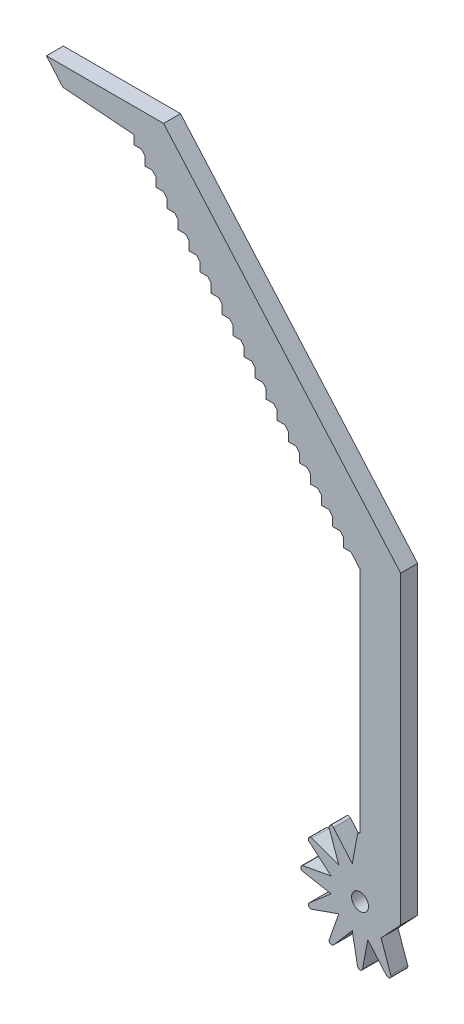
from build123d import *

# Parameters (mm, degrees)
SKETCH2_R           = 8.75
BOSS_EXTRUDE1_DEPTH = 5
SKETCH2_3_R         = 2.5
CUT_EXTRUDE1_DEPTH  = 31
BOSS_EXTRUDE2_DEPTH = 5
CIRPATTERN2_COUNT   = 8
CIRPATTERN2_ANGLE   = 210
BOSS_EXTRUDE3_DEPTH = 5
BOSS_EXTRUDE4_START = -5
BOSS_EXTRUDE4_DEPTH = 5
CUT_EXTRUDE2_START  = -5
SKETCH7_R           = 2.5
CUT_EXTRUDE2_DEPTH  = 5
BOSS_EXTRUDE5_DEPTH = 5
LPATTERN1_COUNT     = 20
LPATTERN1_PITCH     = 5


with BuildPart() as part:
    # Sketch2 → Boss-Extrude1 (new body)
    with BuildSketch(Plane.XY):
        Circle(SKETCH2_R)
    extrude(amount=BOSS_EXTRUDE1_DEPTH)

    # Sketch2<3> → Cut-Extrude1 (cut)
    with BuildSketch(Plane.XY):
        Circle(SKETCH2_3_R)
    extrude(amount=CUT_EXTRUDE1_DEPTH, mode=Mode.SUBTRACT)

    # Sketch2<4> → Boss-Extrude2 (add)
    with BuildSketch(Plane.XY):
        with BuildLine():
            Line((0, 7.99133798), (-2.4, 7.99133798))
            Line((-2.4, 7.99133798), (-0.737233852, 16.887790594))
            ThreePointArc((-0.737233852, 16.887790594), (0, 17.5), (0.737233852, 16.887790594))
            Line((0.737233852, 16.887790594), (2.4, 7.99133798))
            Line((2.4, 7.99133798), (0, 7.99133798))
        make_face()
    boss_extrude2 = extrude(amount=BOSS_EXTRUDE2_DEPTH)

    # CirPattern2: Boss-Extrude2 ×8 about axis
    cirpattern2_axis = Axis((0, 0, 5), (0, 0, 1))
    for i in range(1, CIRPATTERN2_COUNT):
        add(boss_extrude2.rotate(cirpattern2_axis, i * CIRPATTERN2_ANGLE / (CIRPATTERN2_COUNT - 1)))



with BuildPart() as body_2:
    # Sketch5 → Boss-Extrude3 (new body)
    with BuildSketch(Plane.XY):
        Polygon((12, 85), (12, 90), (-58, 170), (-73, 170), (-92.6, 170), (-87.790588235, 164.4), (-66.790588235, 162.769863014), (0, 85), (0, 0), (12, 0), align=None)
    extrude(amount=BOSS_EXTRUDE3_DEPTH)


with BuildPart() as part_1:
    add(part.part)

    add(body_2.part)  # Boss-Extrude4 merges body 2
    # Sketch6 → Boss-Extrude4 (add)
    with BuildSketch(Plane.XY.offset(5).offset(BOSS_EXTRUDE4_START)):
        with BuildLine():
            ThreePointArc((8.75, 0), (8.175439475, -3.118443425), (6.527213853, -5.827347537))
            Line((6.527213853, -5.827347537), (12, 0))
            Line((12, 0), (8.75, 0))
        make_face()
    extrude(amount=BOSS_EXTRUDE4_DEPTH)

    # Sketch7 → Cut-Extrude2 (cut)
    with BuildSketch(Plane.XY.offset(5).offset(CUT_EXTRUDE2_START)):
        Circle(SKETCH7_R)
    extrude(amount=CUT_EXTRUDE2_DEPTH, mode=Mode.SUBTRACT)

    # Sketch8 → Boss-Extrude5 (add)
    with BuildSketch(Plane.XY.offset(5)):
        Polygon((-66.790588235, 162.769863014), (-66.790588235, 160.132718073), (-64.525746109, 160.132718073), align=None)
    boss_extrude5 = extrude(amount=-BOSS_EXTRUDE5_DEPTH)

    # LPattern1: Boss-Extrude5 ×20
    with Locations(*[Vector(0.651526069725242, -0.7586262455704912, 0) * (i * LPATTERN1_PITCH) for i in range(1, LPATTERN1_COUNT)]):
        add(boss_extrude5)


solid = part_1.part
